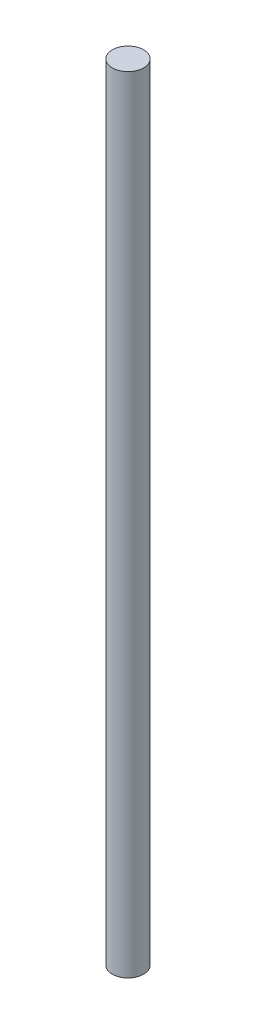
from build123d import *

# Parameters (mm, degrees)
SKETCH1_R           = 2.5
BOSS_EXTRUDE1_DEPTH = 125


with BuildPart() as part:
    # Sketch1 → Boss-Extrude1 (new body)
    with BuildSketch(Plane(origin=(0, 0, 0), x_dir=(1, 0, 0), z_dir=(0, 1, 0))):
        with Locations(Location((0, 0, 0), (0, 0, 270))):
            Circle(SKETCH1_R)
    extrude(amount=BOSS_EXTRUDE1_DEPTH)


solid = part.part
